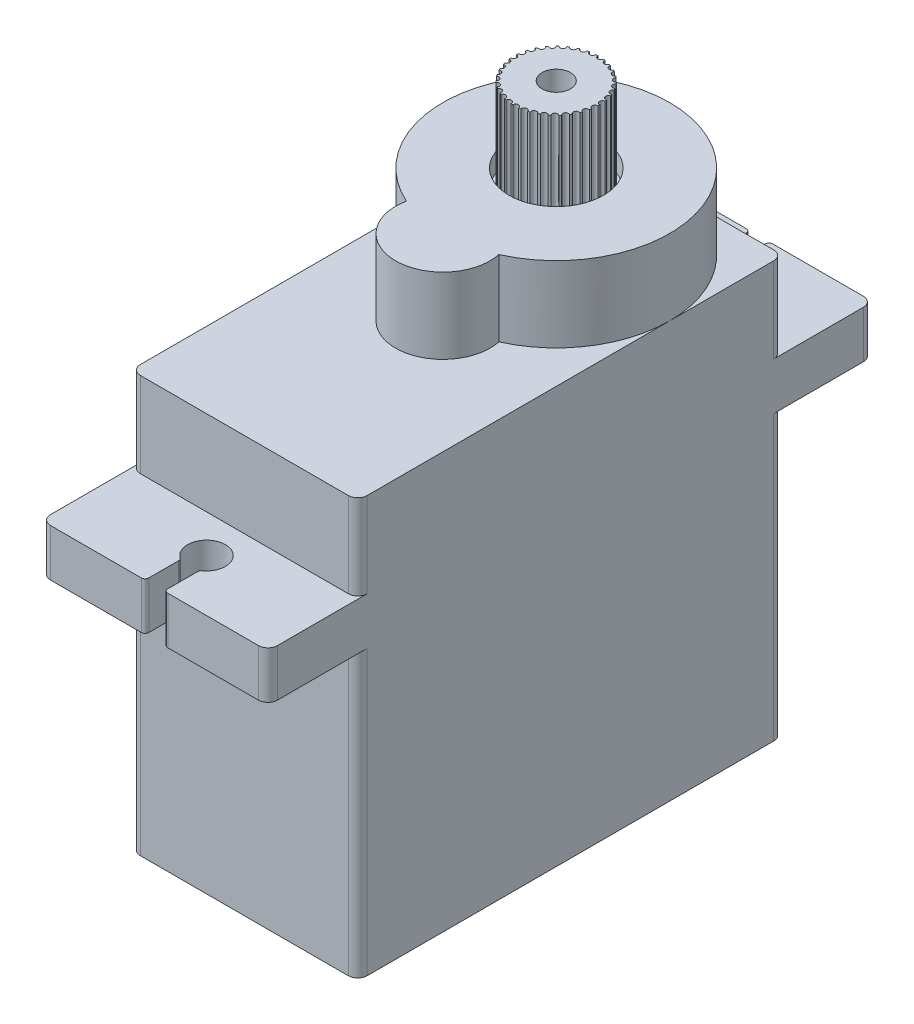
from build123d import *

# Parameters (mm, degrees)
Y_KSEKLIK_EKSTR_ZYON1_DEPTH  = 1
Y_KSEKLIK_EKSTR_ZYON2_DEPTH  = 5
IZIM3_W                      = 4
IZIM3_H                      = 1
KES_EKSTR_ZYON1_DEPTH        = 1
RADYUS1_R                    = 0.1
Y_KSEKLIK_EKSTR_ZYON4_DEPTH  = 9
Y_KSEKLIK_EKSTR_ZYON5_DEPTH  = 2.5
Y_KSEKLIK_EKSTR_ZYON6_DEPTH  = 3.5
Y_KSEKLIK_EKSTR_ZYON7_DEPTH  = 1
KES_EKSTR_ZYON2_DEPTH        = 1
Y_KSEKLIK_EKSTR_ZYON8_START  = 3
Y_KSEKLIK_EKSTR_ZYON8_DEPTH  = 3
RADYUS2_R                    = 0.5
Y_KSEKLIK_EKSTR_ZYON9_START  = 1
Y_KSEKLIK_EKSTR_ZYON9_DEPTH  = 1
IZIM11_R                     = 2.5
KES_EKSTR_ZYON3_DEPTH        = 10
IZIM15_R                     = 0.25
Y_KSEKLIK_EKSTR_ZYON12_DEPTH = 11
IZIM19_R                     = 2.25
Y_KSEKLIK_EKSTR_ZYON17_DEPTH = 5
IZIM20_R                     = 4.75
Y_KSEKLIK_EKSTR_ZYON18_DEPTH = 3
IZIM21_R                     = 0.75
KES_EKSTR_ZYON5_DEPTH        = 10
IZIM22_R                     = 0.5
Y_KSEKLIK_EKSTR_ZYON19_DEPTH = 5
IZIM23_R                     = 4
Y_KSEKLIK_EKSTR_ZYON20_DEPTH = 2
IZIM24_R                     = 0.75
Y_KSEKLIK_EKSTR_ZYON21_DEPTH = 7
IZIM25_R                     = 3.5
Y_KSEKLIK_EKSTR_ZYON22_DEPTH = 1
IZIM26_R                     = 4.5
Y_KSEKLIK_EKSTR_ZYON23_DEPTH = 1
KES_EKSTR_ZYON7_DEPTH        = 30
Y_KSEKLIK_EKSTR_ZYON33_DEPTH = 1
Y_KSEKLIK_EKSTR_ZYON34_DEPTH = 14
IZIM37_W                     = 8
IZIM37_H                     = 6
Y_KSEKLIK_EKSTR_ZYON36_DEPTH = 1
IZIM39_W                     = 4
IZIM39_H                     = 1
Y_KSEKLIK_EKSTR_ZYON37_DEPTH = 0.1
IZIM40_R                     = 0.4
Y_KSEKLIK_EKSTR_ZYON38_DEPTH = 2
IZIM41_R                     = 0.15
KES_EKSTR_ZYON8_DEPTH        = 5


with BuildPart() as part:
    # Çizim1 → Yükseklik-Ekstrüzyon1 (new body)
    with BuildSketch(Plane(origin=(0, 0, 0), x_dir=(1, 0, 0), z_dir=(0, 1, 0))):
        with BuildLine():
            Line((-5.5, 11.25), (5.5, 11.25))
            ThreePointArc((5.5, 11.25), (5.853553391, 11.103553391), (6, 10.75))
            Line((6, 10.75), (6, -10.75))
            ThreePointArc((6, -10.75), (5.853553391, -11.103553391), (5.5, -11.25))
            Line((5.5, -11.25), (-5.5, -11.25))
            ThreePointArc((-5.5, -11.25), (-5.853553391, -11.103553391), (-6, -10.75))
            Line((-6, -10.75), (-6, 10.75))
            ThreePointArc((-6, 10.75), (-5.853553391, 11.103553391), (-5.5, 11.25))
        make_face()
    extrude(amount=Y_KSEKLIK_EKSTR_ZYON1_DEPTH)

    # Çizim2 → Yükseklik-Ekstrüzyon2 (add)
    with BuildSketch(Plane(origin=(0, 1, 0), x_dir=(1, 0, 0), z_dir=(0, 1, 0))):
        with BuildLine():
            Line((-5.5, 11.25), (5.5, 11.25))
            ThreePointArc((5.5, 11.25), (5.853553391, 11.103553391), (6, 10.75))
            Line((6, 10.75), (6, -10.75))
            ThreePointArc((6, -10.75), (5.853553391, -11.103553391), (5.5, -11.25))
            Line((5.5, -11.25), (-5.5, -11.25))
            ThreePointArc((-5.5, -11.25), (-5.853553391, -11.103553391), (-6, -10.75))
            Line((-6, -10.75), (-6, 10.75))
            ThreePointArc((-6, 10.75), (-5.853553391, 11.103553391), (-5.5, 11.25))
        make_face()
        with BuildLine():
            Line((-5, 9.25), (-5, -9.25))
            ThreePointArc((-5, -9.25), (-4.292893219, -9.542893219), (-4, -10.25))
            Line((-4, -10.25), (4, -10.25))
            ThreePointArc((4, -10.25), (4.292893219, -9.542893219), (5, -9.25))
            Line((5, -9.25), (5, 9.25))
            ThreePointArc((5, 9.25), (4.292893219, 9.542893219), (4, 10.25))
            Line((4, 10.25), (-4, 10.25))
            ThreePointArc((-4, 10.25), (-4.292893219, 9.542893219), (-5, 9.25))
        make_face(mode=Mode.SUBTRACT)
    extrude(amount=Y_KSEKLIK_EKSTR_ZYON2_DEPTH)

    # Çizim3 → Kes-Ekstrüzyon1 (cut)
    with BuildSketch(Plane(origin=(0, 6, 0), x_dir=(1, 0, 0), z_dir=(0, 1, 0))):
        with Locations((0, -10.75)):
            Rectangle(IZIM3_W, IZIM3_H)
    extrude(amount=-KES_EKSTR_ZYON1_DEPTH, mode=Mode.SUBTRACT)

    # Radyus1
    radyus1_edges = [part.edges().sort_by_distance(p)[0] for p in [
        (2, 5, 10.75),
        (-2, 5, 10.75),
    ]]
    fillet(radyus1_edges, radius=RADYUS1_R)

    # Çizim4 → Yükseklik-Ekstrüzyon4 (add)
    with BuildSketch(Plane(origin=(0, 6, 0), x_dir=(1, 0, 0), z_dir=(0, 1, 0))):
        with BuildLine():
            Line((5.5, 11.25), (-5.5, 11.25))
            ThreePointArc((-5.5, 11.25), (-5.853553391, 11.103553391), (-6, 10.75))
            Line((-6, 10.75), (-6, -10.75))
            ThreePointArc((-6, -10.75), (-5.853553391, -11.103553391), (-5.5, -11.25))
            Line((-5.5, -11.25), (5.5, -11.25))
            ThreePointArc((5.5, -11.25), (5.853553391, -11.103553391), (6, -10.75))
            Line((6, -10.75), (6, 10.75))
            ThreePointArc((6, 10.75), (5.853553391, 11.103553391), (5.5, 11.25))
        make_face()
        with BuildLine():
            ThreePointArc((-5, 9.25), (-4.292893219, 9.542893219), (-4, 10.25))
            Line((-4, 10.25), (4, 10.25))
            ThreePointArc((4, 10.25), (4.292893219, 9.542893219), (5, 9.25))
            Line((5, 9.25), (5, -9.25))
            ThreePointArc((5, -9.25), (4.292893219, -9.542893219), (4, -10.25))
            Line((4, -10.25), (-4, -10.25))
            ThreePointArc((-4, -10.25), (-4.292893219, -9.542893219), (-5, -9.25))
            Line((-5, -9.25), (-5, 9.25))
        make_face(mode=Mode.SUBTRACT)
    extrude(amount=Y_KSEKLIK_EKSTR_ZYON4_DEPTH)

    # Çizim6 → Yükseklik-Ekstrüzyon5 (add)
    with BuildSketch(Plane(origin=(0, 15, 0), x_dir=(1, 0, 0), z_dir=(0, 1, 0))):
        with BuildLine():
            Line((-5.5, 16), (-0.7, 16))
            ThreePointArc((-0.7, 16), (-0.558578644, 15.941421356), (-0.5, 15.8))
            Line((-0.5, 15.8), (-0.5, 14.224679434))
            ThreePointArc((-0.5, 14.224679434), (-0.522048696, 14.133392342), (-0.583333333, 14.062232862))
            ThreePointArc((-0.583333333, 14.062232862), (0, 12.25), (0.583333333, 14.062232862))
            ThreePointArc((0.583333333, 14.062232862), (0.522048696, 14.133392342), (0.5, 14.224679434))
            Line((0.5, 14.224679434), (0.5, 15.8))
            ThreePointArc((0.5, 15.8), (0.558578644, 15.941421356), (0.7, 16))
            Line((0.7, 16), (5.5, 16))
            ThreePointArc((5.5, 16), (5.853553391, 15.853553391), (6, 15.5))
            Line((6, 15.5), (6, -15.5))
            ThreePointArc((6, -15.5), (5.853553391, -15.853553391), (5.5, -16))
            Line((5.5, -16), (0.7, -16))
            ThreePointArc((0.7, -16), (0.558578644, -15.941421356), (0.5, -15.8))
            Line((0.5, -15.8), (0.5, -14.224679434))
            ThreePointArc((0.5, -14.224679434), (0.522048696, -14.133392342), (0.583333333, -14.062232862))
            ThreePointArc((0.583333333, -14.062232862), (0, -12.25), (-0.583333333, -14.062232862))
            ThreePointArc((-0.583333333, -14.062232862), (-0.522048696, -14.133392342), (-0.5, -14.224679434))
            Line((-0.5, -14.224679434), (-0.5, -15.8))
            ThreePointArc((-0.5, -15.8), (-0.558578644, -15.941421356), (-0.7, -16))
            Line((-0.7, -16), (-5.5, -16))
            ThreePointArc((-5.5, -16), (-5.853553391, -15.853553391), (-6, -15.5))
            Line((-6, -15.5), (-6, 15.5))
            ThreePointArc((-6, 15.5), (-5.853553391, 15.853553391), (-5.5, 16))
        make_face()
        with BuildLine():
            Line((-4, 10.25), (4, 10.25))
            ThreePointArc((4, 10.25), (4.292893219, 9.542893219), (5, 9.25))
            Line((5, 9.25), (5, -9.25))
            ThreePointArc((5, -9.25), (4.292893219, -9.542893219), (4, -10.25))
            Line((4, -10.25), (-4, -10.25))
            ThreePointArc((-4, -10.25), (-4.292893219, -9.542893219), (-5, -9.25))
            Line((-5, -9.25), (-5, 9.25))
            ThreePointArc((-5, 9.25), (-4.292893219, 9.542893219), (-4, 10.25))
        make_face(mode=Mode.SUBTRACT)
    extrude(amount=Y_KSEKLIK_EKSTR_ZYON5_DEPTH)

    # Çizim7 → Yükseklik-Ekstrüzyon6 (add)
    with BuildSketch(Plane(origin=(0, 17.5, 0), x_dir=(1, 0, 0), z_dir=(0, 1, 0))):
        with BuildLine():
            Line((5.5, 11.25), (-5.5, 11.25))
            ThreePointArc((-5.5, 11.25), (-5.853553391, 11.103553391), (-6, 10.75))
            Line((-6, 10.75), (-6, -10.75))
            ThreePointArc((-6, -10.75), (-5.853553391, -11.103553391), (-5.5, -11.25))
            Line((-5.5, -11.25), (5.5, -11.25))
            ThreePointArc((5.5, -11.25), (5.853553391, -11.103553391), (6, -10.75))
            Line((6, -10.75), (6, 10.75))
            ThreePointArc((6, 10.75), (5.853553391, 11.103553391), (5.5, 11.25))
        make_face()
        with BuildLine():
            Line((-5, -9.25), (-5, 9.25))
            ThreePointArc((-5, 9.25), (-4.292893219, 9.542893219), (-4, 10.25))
            Line((-4, 10.25), (4, 10.25))
            ThreePointArc((4, 10.25), (4.292893219, 9.542893219), (5, 9.25))
            Line((5, 9.25), (5, -9.25))
            ThreePointArc((5, -9.25), (4.292893219, -9.542893219), (4, -10.25))
            Line((4, -10.25), (-4, -10.25))
            ThreePointArc((-4, -10.25), (-4.292893219, -9.542893219), (-5, -9.25))
        make_face(mode=Mode.SUBTRACT)
    extrude(amount=Y_KSEKLIK_EKSTR_ZYON6_DEPTH)

    # Çizim8 → Yükseklik-Ekstrüzyon7 (add)
    with BuildSketch(Plane(origin=(0, 21, 0), x_dir=(1, 0, 0), z_dir=(0, 1, 0))):
        with BuildLine():
            Line((-5.5, 11.25), (5.5, 11.25))
            ThreePointArc((5.5, 11.25), (5.853553391, 11.103553391), (6, 10.75))
            Line((6, 10.75), (6, -10.75))
            ThreePointArc((6, -10.75), (5.853553391, -11.103553391), (5.5, -11.25))
            Line((5.5, -11.25), (-5.5, -11.25))
            ThreePointArc((-5.5, -11.25), (-5.853553391, -11.103553391), (-6, -10.75))
            Line((-6, -10.75), (-6, 10.75))
            ThreePointArc((-6, 10.75), (-5.853553391, 11.103553391), (-5.5, 11.25))
        make_face()
    extrude(amount=Y_KSEKLIK_EKSTR_ZYON7_DEPTH)

    # Çizim9 → Kes-Ekstrüzyon2 (cut)
    with BuildSketch(Plane(origin=(0, 22, 0), x_dir=(1, 0, 0), z_dir=(0, 1, 0))):
        with BuildLine():
            ThreePointArc((1.015291078, 0.354166667), (0, 10.25), (-1.015291078, 0.354166667))
            ThreePointArc((-1.015291078, 0.354166667), (0, -2.25), (1.015291078, 0.354166667))
        make_face()
    extrude(amount=-KES_EKSTR_ZYON2_DEPTH, mode=Mode.SUBTRACT)

    # Çizim9<3> → Yükseklik-Ekstrüzyon8 (add)
    with BuildSketch(Plane(origin=(0, 22, 0), x_dir=(1, 0, 0), z_dir=(0, 1, 0)).offset(Y_KSEKLIK_EKSTR_ZYON8_START)):
        with BuildLine():
            ThreePointArc((2.445144707, -0.229166667), (0, 11.25), (-2.445144707, -0.229166667))
            ThreePointArc((-2.445144707, -0.229166667), (0, -3.25), (2.445144707, -0.229166667))
        make_face()
        with BuildLine():
            ThreePointArc((1.015291078, 0.354166667), (0, 10.25), (-1.015291078, 0.354166667))
            ThreePointArc((-1.015291078, 0.354166667), (0, -2.25), (1.015291078, 0.354166667))
        make_face(mode=Mode.SUBTRACT)
    extrude(amount=-Y_KSEKLIK_EKSTR_ZYON8_DEPTH)

    # Radyus2
    radyus2_edges = [part.edges().sort_by_distance(p)[0] for p in [
        (-1.015291078, 23, -0.354166667),
        (1.015291078, 23, -0.354166667),
    ]]
    fillet(radyus2_edges, radius=RADYUS2_R)

    # Çizim10 → Yükseklik-Ekstrüzyon9 (add)
    with BuildSketch(Plane(origin=(0, 25, 0), x_dir=(1, 0, 0), z_dir=(0, 1, 0)).offset(Y_KSEKLIK_EKSTR_ZYON9_START)):
        with BuildLine():
            ThreePointArc((2.445144707, -0.229166667), (0, 11.25), (-2.445144707, -0.229166667))
            ThreePointArc((-2.445144707, -0.229166667), (0, -3.25), (2.445144707, -0.229166667))
        make_face()
    extrude(amount=-Y_KSEKLIK_EKSTR_ZYON9_DEPTH)

    # Çizim11 → Kes-Ekstrüzyon3 (cut)
    with BuildSketch(Plane(origin=(0, 26, 0), x_dir=(1, 0, 0), z_dir=(0, 1, 0))):
        with Locations(Location((0, 5.25, 0), (0, 0, 270))):
            Circle(IZIM11_R)
    extrude(amount=-KES_EKSTR_ZYON3_DEPTH, mode=Mode.SUBTRACT)

    # Çizim15 → Yükseklik-Ekstrüzyon12 (add)
    with BuildSketch(Plane(origin=(0, 26, 0), x_dir=(1, 0, 0), z_dir=(0, 1, 0))):
        with Locations(Location((0, -0.75, 0), (0, 0, 270))):
            Circle(IZIM15_R)
    extrude(amount=-Y_KSEKLIK_EKSTR_ZYON12_DEPTH)



with BuildPart() as body_2:
    # Çizim19 → Yükseklik-Ekstrüzyon17 (new body)
    with BuildSketch(Plane(origin=(0, 30, 0), x_dir=(1, 0, 0), z_dir=(0, 1, 0))):
        with Locations(Location((0, 5.25, 0), (0, 0, 270))):
            Circle(IZIM19_R)
    extrude(amount=-Y_KSEKLIK_EKSTR_ZYON17_DEPTH)


with BuildPart() as part_1:
    add(part.part)

    add(body_2.part)  # Yükseklik-Ekstrüzyon18 merges body 2
    # Çizim20 → Yükseklik-Ekstrüzyon18 (add)
    with BuildSketch(Plane.XZ.offset(-25)):
        with Locations(Location((0, -5.25, 0), (0, 0, 90))):
            Circle(IZIM20_R)
    extrude(amount=Y_KSEKLIK_EKSTR_ZYON18_DEPTH)

    # Çizim21 → Kes-Ekstrüzyon5 (cut)
    with BuildSketch(Plane(origin=(0, 30, 0), x_dir=(1, 0, 0), z_dir=(0, 1, 0))):
        with Locations(Location((0, 5.25, 0), (0, 0, 270))):
            Circle(IZIM21_R)
    extrude(amount=-KES_EKSTR_ZYON5_DEPTH, mode=Mode.SUBTRACT)

    # Çizim22 → Yükseklik-Ekstrüzyon19 (add)
    with BuildSketch(Plane(origin=(0, 25.5, 0), x_dir=(1, 0, 0), z_dir=(0, 1, 0))):
        with Locations(Location((0, -0.75, 0), (0, 0, 270))):
            Circle(IZIM22_R)
    extrude(amount=-Y_KSEKLIK_EKSTR_ZYON19_DEPTH)

    # Çizim23 → Yükseklik-Ekstrüzyon20 (add)
    with BuildSketch(Plane.XZ.offset(-20.5)):
        with Locations(Location((0, 0.75, 0), (0, 0, 270))):
            Circle(IZIM23_R)
    extrude(amount=Y_KSEKLIK_EKSTR_ZYON20_DEPTH)

    # Çizim26 → Yükseklik-Ekstrüzyon23 (add)
    with BuildSketch(Plane(origin=(0, 17.5, 0), x_dir=(-1, 0, 0), z_dir=(0, -1, 0))):
        with Locations(Location((0, -0.75, 0), (0, 0, 90))):
            Circle(IZIM26_R)
    extrude(amount=Y_KSEKLIK_EKSTR_ZYON23_DEPTH)

    # Çizim32 → Kes-Ekstrüzyon7 (cut)
    with BuildSketch(Plane(origin=(0, 0, 10.25), x_dir=(-1, 0, 0), z_dir=(0, 0, -1))):
        with BuildLine():
            Line((2, 6), (-2, 6))
            Line((-2, 6), (-2, 5.1))
            ThreePointArc((-2, 5.1), (-1.970710678, 5.029289322), (-1.9, 5))
            Line((-1.9, 5), (1.9, 5))
            ThreePointArc((1.9, 5), (1.970710678, 5.029289322), (2, 5.1))
            Line((2, 5.1), (2, 6))
        make_face()
    extrude(amount=KES_EKSTR_ZYON7_DEPTH, mode=Mode.SUBTRACT)

    # Çizim33 → Yükseklik-Ekstrüzyon33 (add)
    with BuildSketch(Plane.XY.offset(11.25)):
        with BuildLine():
            Line((-2, 6), (2, 6))
            Line((2, 6), (2, 5.1))
            ThreePointArc((2, 5.1), (1.970710678, 5.029289322), (1.9, 5))
            Line((1.9, 5), (-1.9, 5))
            ThreePointArc((-1.9, 5), (-1.970710678, 5.029289322), (-2, 5.1))
            Line((-2, 5.1), (-2, 6))
        make_face()
    extrude(amount=-Y_KSEKLIK_EKSTR_ZYON33_DEPTH)

    # Çizim34 → Yükseklik-Ekstrüzyon34 (add)
    with BuildSketch(Plane(origin=(0, 1, 0), x_dir=(1, 0, 0), z_dir=(0, 1, 0))):
        with BuildLine():
            Line((-3, -3.25), (3, -3.25))
            ThreePointArc((3, -3.25), (3.707106781, -3.542893219), (4, -4.25))
            Line((4, -4.25), (4, -8.25))
            ThreePointArc((4, -8.25), (3.707106781, -8.957106781), (3, -9.25))
            Line((3, -9.25), (-3, -9.25))
            ThreePointArc((-3, -9.25), (-3.707106781, -8.957106781), (-4, -8.25))
            Line((-4, -8.25), (-4, -4.25))
            ThreePointArc((-4, -4.25), (-3.707106781, -3.542893219), (-3, -3.25))
        make_face()
    extrude(amount=Y_KSEKLIK_EKSTR_ZYON34_DEPTH)

    # Çizim37 → Yükseklik-Ekstrüzyon36 (add)
    with BuildSketch(Plane(origin=(0, 1, 0), x_dir=(-1, 0, 0), z_dir=(0, -1, 0))):
        with Locations((0, -6.25)):
            Rectangle(IZIM37_W, IZIM37_H)
    extrude(amount=-Y_KSEKLIK_EKSTR_ZYON36_DEPTH)

    # Çizim39 → Yükseklik-Ekstrüzyon37 (add)
    with BuildSketch(Plane(origin=(0, 0, -10.75), x_dir=(-1, 0, 0), z_dir=(0, 0, -1))):
        with Locations((0, 5.514566781)):
            Rectangle(IZIM39_W, IZIM39_H)
    extrude(amount=Y_KSEKLIK_EKSTR_ZYON37_DEPTH)

    # Çizim40 → Yükseklik-Ekstrüzyon38 (add)
    with BuildSketch(Plane(origin=(0, 0, -10.85), x_dir=(-1, 0, 0), z_dir=(0, 0, -1))):
        with Locations((0, 5.55)):
            Circle(IZIM40_R)
        with Locations((1, 5.55)):
            Circle(IZIM40_R)
        with Locations((-1, 5.55)):
            Circle(IZIM40_R)
    extrude(amount=Y_KSEKLIK_EKSTR_ZYON38_DEPTH)

    # Çizim41 → Kes-Ekstrüzyon8 (cut)
    with BuildSketch(Plane(origin=(0, 30, 0), x_dir=(1, 0, 0), z_dir=(0, 1, 0))):
        with Locations((-2.25, 5.25)):
            Circle(IZIM41_R)
        with Locations((-2.213841574, 5.651753013)):
            Circle(IZIM41_R)
        with Locations((-2.106528459, 6.040593354)):
            Circle(IZIM41_R)
        with Locations((-1.931509786, 6.404023374)):
            Circle(IZIM41_R)
        with Locations((-1.694410799, 6.730362133)):
            Circle(IZIM41_R)
        with Locations((-1.402852054, 7.009120836)):
            Circle(IZIM41_R)
        with Locations((-1.066204491, 7.231339947)):
            Circle(IZIM41_R)
        with Locations((-0.695288237, 7.389877162)):
            Circle(IZIM41_R)
        with Locations((-0.302024848, 7.479636964)):
            Circle(IZIM41_R)
        with Locations((0.100945868, 7.4977344)):
            Circle(IZIM41_R)
        with Locations((0.500672101, 7.443587802)):
            Circle(IZIM41_R)
        with Locations((0.884306321, 7.318937488)):
            Circle(IZIM41_R)
        with Locations((1.239518208, 7.127789821)):
            Circle(IZIM41_R)
        with Locations((1.55489096, 6.876288444)):
            Circle(IZIM41_R)
        with Locations((1.820288237, 6.572516818)):
            Circle(IZIM41_R)
        with Locations((2.027179953, 6.226238413)):
            Circle(IZIM41_R)
        with Locations((2.168916437, 5.848582903)):
            Circle(IZIM41_R)
        with Locations((2.240942161, 5.451688445)):
            Circle(IZIM41_R)
        with Locations((2.240942161, 5.048311555)):
            Circle(IZIM41_R)
        with Locations((2.168916437, 4.651417097)):
            Circle(IZIM41_R)
        with Locations((2.027179953, 4.273761587)):
            Circle(IZIM41_R)
        with Locations((1.820288237, 3.927483182)):
            Circle(IZIM41_R)
        with Locations((1.55489096, 3.623711556)):
            Circle(IZIM41_R)
        with Locations((1.239518208, 3.372210179)):
            Circle(IZIM41_R)
        with Locations((0.884306321, 3.181062512)):
            Circle(IZIM41_R)
        with Locations((0.500672101, 3.056412198)):
            Circle(IZIM41_R)
        with Locations((0.100945868, 3.0022656)):
            Circle(IZIM41_R)
        with Locations((-0.302024848, 3.020363036)):
            Circle(IZIM41_R)
        with Locations((-0.695288237, 3.110122838)):
            Circle(IZIM41_R)
        with Locations((-1.066204491, 3.268660053)):
            Circle(IZIM41_R)
        with Locations((-1.402852054, 3.490879164)):
            Circle(IZIM41_R)
        with Locations((-1.694410799, 3.769637867)):
            Circle(IZIM41_R)
        with Locations((-1.931509786, 4.095976626)):
            Circle(IZIM41_R)
        with Locations((-2.106528459, 4.459406646)):
            Circle(IZIM41_R)
        with Locations((-2.213841574, 4.848246987)):
            Circle(IZIM41_R)
    extrude(amount=-KES_EKSTR_ZYON8_DEPTH, mode=Mode.SUBTRACT)


with BuildPart() as body_2_2:
    # Çizim24 → Yükseklik-Ekstrüzyon21 (new body)
    with BuildSketch(Plane.XZ.offset(-22)):
        with Locations(Location((0, -5.25, 0), (0, 0, 270))):
            Circle(IZIM24_R)
    extrude(amount=Y_KSEKLIK_EKSTR_ZYON21_DEPTH)

    # Çizim25 → Yükseklik-Ekstrüzyon22 (add)
    with BuildSketch(Plane(origin=(0, 19, 0), x_dir=(-1, 0, 0), z_dir=(0, -1, 0))):
        with Locations(Location((0, 5.25, 0), (0, 0, 90))):
            Circle(IZIM25_R)
    extrude(amount=Y_KSEKLIK_EKSTR_ZYON22_DEPTH)


solid = Compound([part_1.part, body_2_2.part])
